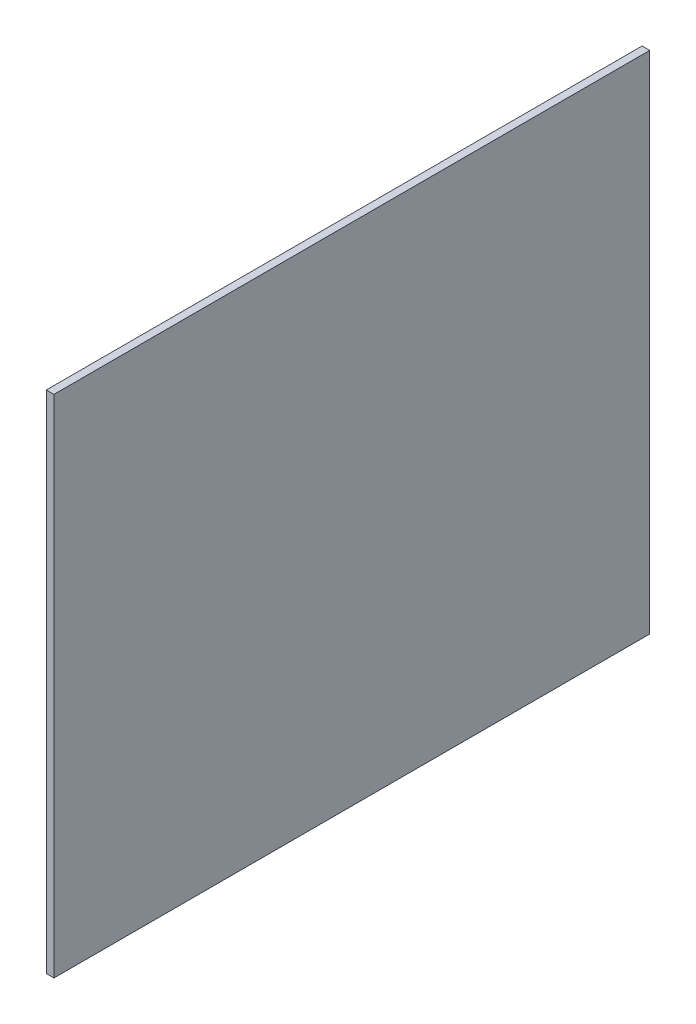
from build123d import *

# Parameters (mm, degrees)
SKETCH2_W           = 123.952
SKETCH2_H           = 105.156
BOSS_EXTRUDE1_DEPTH = 1.5875


with BuildPart() as part:
    # Sketch2 → Boss-Extrude1 (new body)
    with BuildSketch(Plane(origin=(0, 0, 0), x_dir=(0, 0, -1), z_dir=(1, 0, 0))):
        Rectangle(SKETCH2_W, SKETCH2_H)
    extrude(amount=BOSS_EXTRUDE1_DEPTH)


solid = part.part
